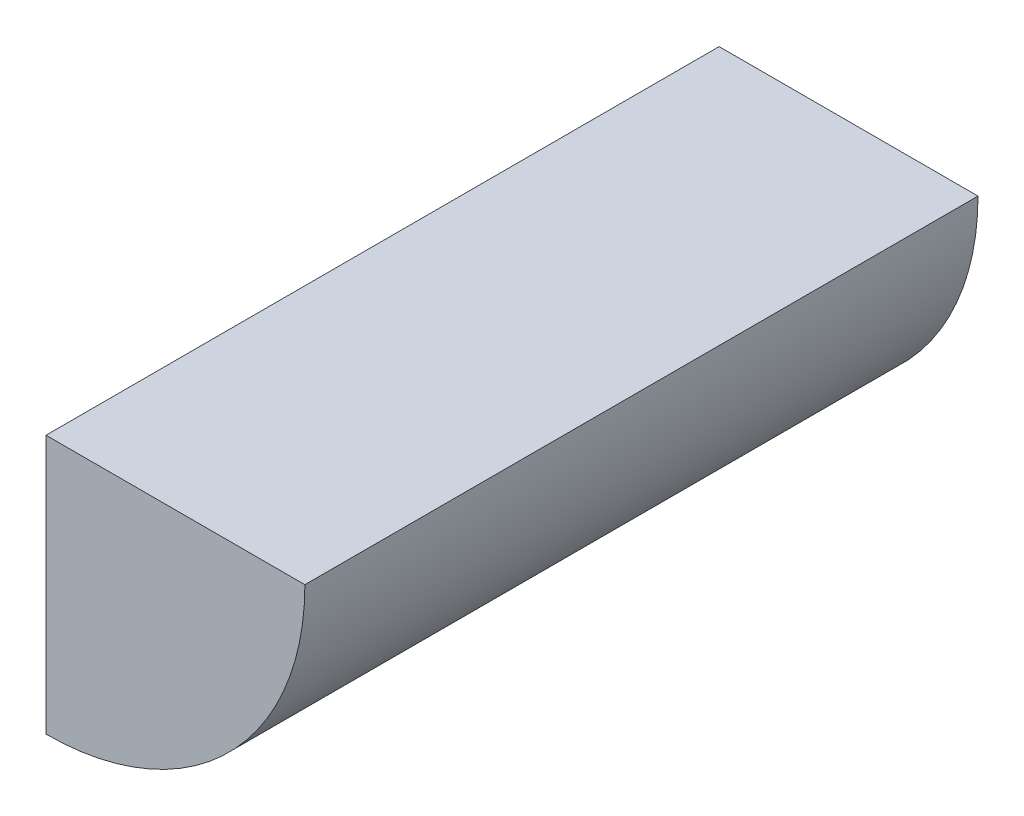
from build123d import *

# Parameters (mm, degrees)
BOSS_EXTRUDE1_DEPTH = 65


with BuildPart() as part:
    # Sketch1 → Boss-Extrude1 (new body)
    with BuildSketch(Plane.XY):
        with BuildLine():
            Line((0, 19.959076481), (0, -5.040923519))
            ThreePointArc((0, -5.040923519), (17.67766953, 2.281406951), (25, 19.959076481))
            Line((25, 19.959076481), (0, 19.959076481))
        make_face()
    extrude(amount=BOSS_EXTRUDE1_DEPTH)


solid = part.part
